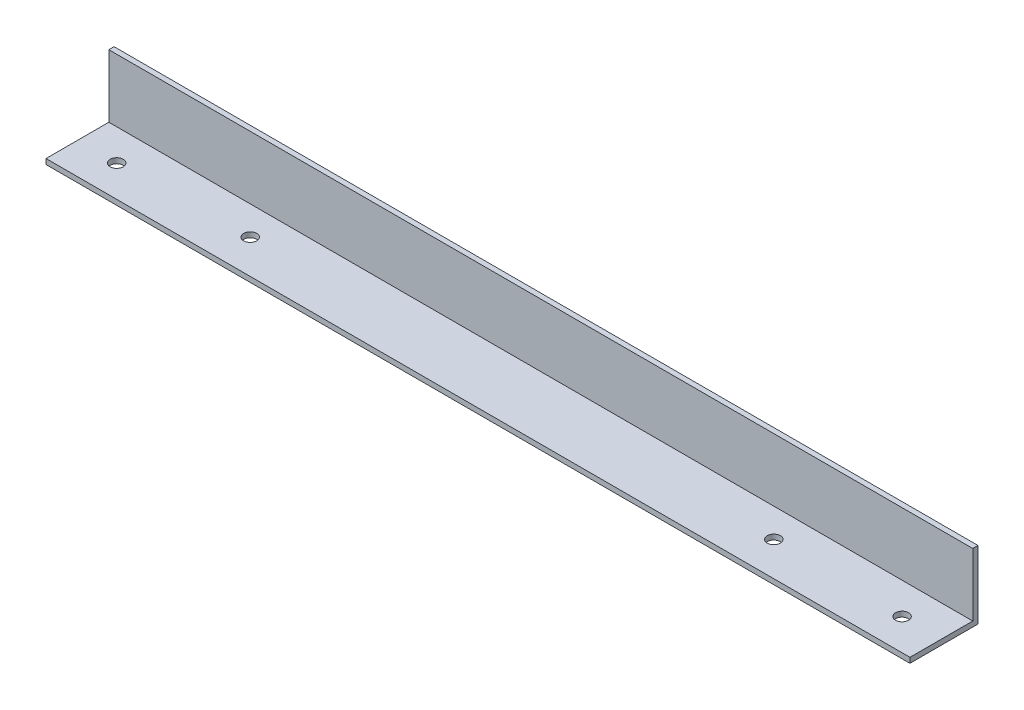
from build123d import *

# Parameters (mm, degrees)
BOSS_EXTRUDE1_DEPTH = 165
SKETCH2_R           = 2.5
CUT_EXTRUDE1_DEPTH  = 167.021082999
SKETCH3_R           = 2.5
CUT_EXTRUDE2_DEPTH  = 167.021082999


with BuildPart() as part:
    # Sketch1 → Boss-Extrude1 (new, symmetric)
    with BuildSketch(Plane(origin=(0, 0, 0), x_dir=(0, 0, -1), z_dir=(1, 0, 0))):
        Polygon((11, 13), (13, 13), (13, -13), (-13, -13), (-13, -11), (11, -11), align=None)
    extrude(amount=BOSS_EXTRUDE1_DEPTH, both=True)

    # Sketch2 → Cut-Extrude1 (cut, through all)
    with BuildSketch(Plane(origin=(0, 0, 0), x_dir=(1, 0, 0), z_dir=(0, 1, 0))):
        with Locations(Location((150, -1, 0), (0, 0, 270))):
            Circle(SKETCH2_R)
    cut_extrude1 = extrude(amount=-CUT_EXTRUDE1_DEPTH, mode=Mode.SUBTRACT)

    # Mirror1: Cut-Extrude1 across plane
    add(cut_extrude1.mirror(Plane(origin=(0, 0, 0), x_dir=(0, 0, 1), z_dir=(1, 0, 0))), mode=Mode.SUBTRACT)

    # Sketch3 → Cut-Extrude2 (cut, through all)
    with BuildSketch(Plane(origin=(0, 0, 0), x_dir=(1, 0, 0), z_dir=(0, 1, 0))):
        with Locations(Location((100, 0, 0), (0, 0, 270))):
            Circle(SKETCH3_R)
    cut_extrude2 = extrude(amount=-CUT_EXTRUDE2_DEPTH, mode=Mode.SUBTRACT)

    # Mirror2: Cut-Extrude2 across plane
    add(cut_extrude2.mirror(Plane(origin=(0, 0, 0), x_dir=(0, 0, 1), z_dir=(1, 0, 0))), mode=Mode.SUBTRACT)


solid = part.part
